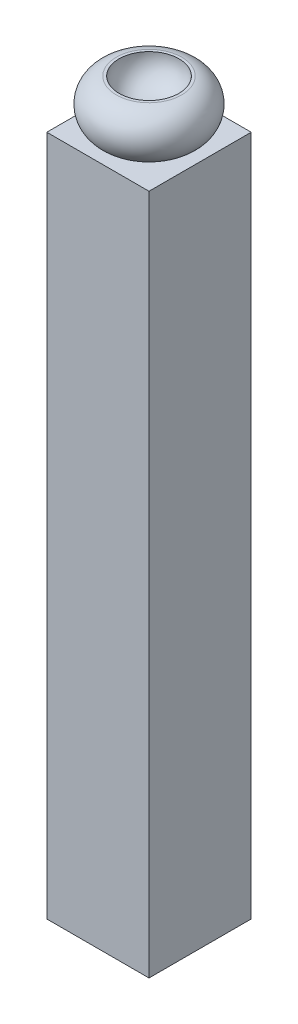
from build123d import *

# Parameters (mm, degrees)
SKETCH4_W           = 19.05
SKETCH4_H           = 19.05
BOSS_EXTRUDE1_DEPTH = 127


with BuildPart() as part:
    # Sketch2 → Revolve2 (revolve)
    with BuildSketch(Plane.XY, mode=Mode.PRIVATE) as revolve2_sk:
        with BuildLine():
            Line((0, 8.168367528), (0, 3.636735056))
            Line((0, 3.636735056), (4.947214611, 3.636735056))
            ThreePointArc((4.947214611, 3.636735056), (9.865040683, 7.617829413), (6.096, 12.7))
            Line((6.096, 12.7), (5.588, 12.7))
            ThreePointArc((5.588, 12.7), (3.946698626, 9.012779896), (0, 8.168367528))
        make_face()
    revolve(revolve2_sk.sketch.rotate(Axis((0, 3.636735056, 0), (0, 1, 0)), 90), axis=Axis((0, 3.636735056, 0), (0, 1, 0)))

    # Sketch4 → Boss-Extrude1 (add)
    with BuildSketch(Plane.XZ.offset(-3.636735056)):
        Rectangle(SKETCH4_W, SKETCH4_H)
    extrude(amount=BOSS_EXTRUDE1_DEPTH)


solid = part.part
